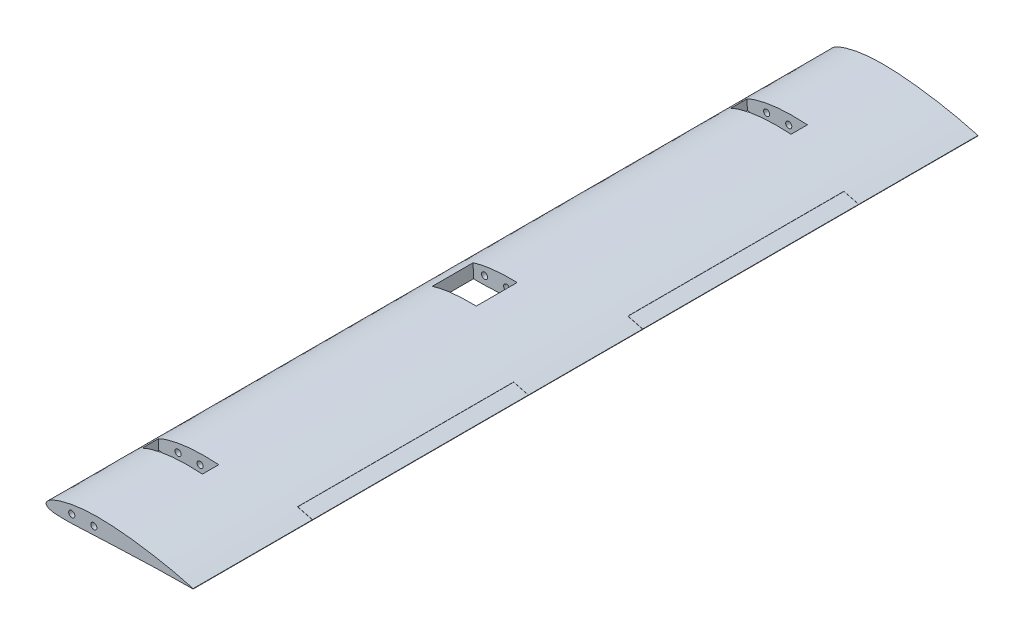
from build123d import *

# Parameters (mm, degrees)
SKETCH2_R               = 4.7625
EXTRUDE_AIRFOIL_DEPTH   = 1219.2
AILERONS_DEPTH          = 1241.930446903
AILERONS_DEPTH_BACK     = 1241.930446903
CUT_EXTRUDE1_DEPTH      = 1241.650515326
CUT_EXTRUDE1_DEPTH_BACK = 1241.650515326
SKETCH5_W               = 25.4
SKETCH5_H               = 93.98
SKETCH5_W_2             = 63.5
SKETCH5_H_2             = 68.58


with BuildPart() as part:
    # Sketch2 → Extrude airfoil (new body)
    with BuildSketch(Plane.XY):
        with BuildLine():
            Line((228.6, 12.387025086), (228.6, 11.792831891))
            add(Edge.make_bspline(
                [(228.6, 12.387025086), (224.79499634, 13.422833003), (217.203351463, 15.489450166), (201.995086366, 19.24706995), (182.976626701, 23.398782778), (160.101034919, 27.491378445), (137.243176809, 30.846032277), (114.372582505, 33.23890504), (91.503980941, 34.73131665), (72.412997667, 34.746410141), (57.169927463, 33.691843848), (45.722178876, 32.302790192), (34.249688597, 30.254339076), (24.742840243, 27.790786051), (17.124502123, 25.302700119), (11.38009907, 22.953832003), (6.478661385, 20.413593164), (2.224209454, 17.375019555), (-1.479318567, 12.488031674), (2.518152586, 8.750563835), (6.597176672, 7.283468722), (11.455013829, 6.293244116), (17.192107473, 5.789786203), (24.819037957, 5.433479126), (34.346917188, 5.460166768), (45.776283997, 5.77999863), (57.197586321, 6.388979964), (72.433369023, 7.101546318), (91.474845089, 8.015960902), (114.332736884, 8.874603332), (137.183285679, 9.828052553), (160.036020936, 10.640146808), (182.890586988, 11.237493082), (201.936912913, 11.54078297), (217.172860417, 11.740515028), (224.791022029, 11.77539325), (228.6, 11.792831891)],
                knots=[0, 0, 0, 0, 0.025304886, 0.050487653, 0.100520433, 0.150190716, 0.199586607, 0.248740009, 0.297715539, 0.346600594, 0.371102737, 0.395726297, 0.420570145, 0.445825119, 0.458702216, 0.471919982, 0.485786003, 0.493461051, 0.506863029, 0.51614777, 0.522766003, 0.535269014, 0.547551134, 0.559786371, 0.584228898, 0.60868081, 0.633151284, 0.657621757, 0.706558114, 0.75548187, 0.804405627, 0.853320224, 0.902221408, 0.951113136, 0.975557228, 1, 1, 1, 1], degree=3))
        make_face()
        with Locations(Location((40.005, 18.43992729, 0), (0, 0, 180))):
            Circle(SKETCH2_R, mode=Mode.SUBTRACT)
        with Locations(Location((74.283249673, 19.337534848, 0), (0, 0, 180))):
            Circle(SKETCH2_R, mode=Mode.SUBTRACT)
    extrude(amount=EXTRUDE_AIRFOIL_DEPTH)

    # Sketch3 → Ailerons (cut, two sides: drawn at the far end of the back side and taken through both)
    with BuildSketch(Plane(origin=(0, 0, 0), x_dir=(1, 0, 0), z_dir=(0, 1, 0)).offset(-AILERONS_DEPTH_BACK)):
        Polygon((228.6, -520.7), (205.74, -520.7), (205.74, -185.42), (228.6, -185.42), (228.6, -185.166), (205.486, -185.166), (205.486, -520.954), (228.6, -520.954), align=None)
        Polygon((228.6, -1033.78), (205.74, -1033.78), (205.74, -698.5), (228.6, -698.5), (228.6, -698.246), (205.486, -698.246), (205.486, -1034.034), (228.6, -1034.034), align=None)
    extrude(amount=AILERONS_DEPTH + AILERONS_DEPTH_BACK, mode=Mode.SUBTRACT)


with BuildPart() as ailerons_piece_1:
    # of the separate pieces the step leaves, piece 1, a body of its own (ailerons_pieces)
    add(part.part.solids().sort_by_distance((228.6, 12.387025086, 0))[0])

    # Sketch5 → Cut-Extrude1 (cut, two sides: drawn at the far end of the back side and taken through both)
    with BuildSketch(Plane(origin=(-0.455122883, 17.380441686, 0), x_dir=(0, 0, -1), z_dir=(-0.026176948307859344, 0.9996573249755578, 0)).offset(-CUT_EXTRUDE1_DEPTH_BACK)):
        with Locations((-1066.8, -57.15)):
            Rectangle(SKETCH5_W, SKETCH5_H)
        with Locations((-152.4, -57.15)):
            Rectangle(SKETCH5_W, SKETCH5_H)
        with Locations((-609.6, -57.15)):
            Rectangle(SKETCH5_W_2, SKETCH5_H_2)
    extrude(amount=CUT_EXTRUDE1_DEPTH + CUT_EXTRUDE1_DEPTH_BACK, mode=Mode.SUBTRACT)


with BuildPart() as ailerons_piece_2:
    # of the separate pieces the step leaves, piece 2, a body of its own (ailerons_pieces)
    add(part.part.solids().sort_by_distance((228.6, 11.792831891, 185.42))[0])


with BuildPart() as ailerons_piece_3:
    # of the separate pieces the step leaves, piece 3, a body of its own (ailerons_pieces)
    add(part.part.solids().sort_by_distance((228.6, 11.792831891, 698.5))[0])


solid = Compound([ailerons_piece_1.part, ailerons_piece_2.part, ailerons_piece_3.part])
